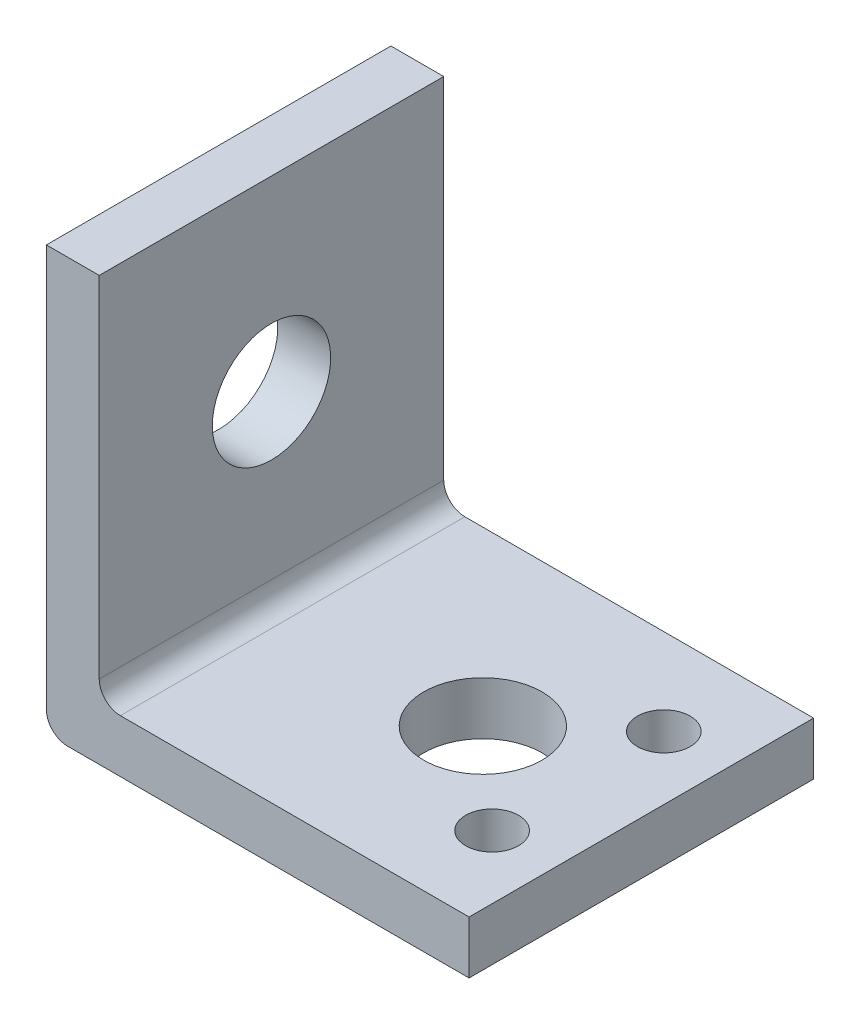
from build123d import *

# Parameters (mm, degrees)
EXTRUDE_1_DEPTH     = 41.402
SKETCH_4_R          = 7.112
CUT_EXTRUDE_1_DEPTH = 83.979969858
SKETCH_3_R          = 7.112
CUT_EXTRUDE_2_DEPTH = 83.979969858
SKETCH1_R           = 3.175
CUT_EXTRUDE1_DEPTH  = 83.979969858


with BuildPart() as part:
    # 草图1 → 凸台-拉伸1 (new body)
    with BuildSketch(Plane.XY):
        with BuildLine():
            Line((2.54, 0), (50.8, 0))
            Line((50.8, 0), (50.8, 6.35))
            Line((50.8, 6.35), (8.89, 6.35))
            ThreePointArc((8.89, 6.35), (7.093948776, 7.093948776), (6.35, 8.89))
            Line((6.35, 8.89), (6.35, 50.900980282))
            Line((6.35, 50.900980282), (0, 50.900980282))
            Line((0, 50.900980282), (0, 2.54))
            ThreePointArc((0, 2.54), (0.743948776, 0.743948776), (2.54, 0))
        make_face()
    extrude(amount=EXTRUDE_1_DEPTH)

    # 草图4 → 切除-拉伸1 (cut, through all)
    with BuildSketch(Plane.ZY):
        with Locations((20.701, 28.448)):
            Circle(SKETCH_4_R)
    extrude(amount=-CUT_EXTRUDE_1_DEPTH, mode=Mode.SUBTRACT)

    # 草图3 → 切除-拉伸2 (cut, through all)
    with BuildSketch(Plane(origin=(0, 0, 0), x_dir=(-1, 0, 0), z_dir=(0, -1, 0))):
        with Locations(Location((-31.75, -20.701, 0), (0, 0, 90))):
            Circle(SKETCH_3_R)
    extrude(amount=-CUT_EXTRUDE_2_DEPTH, mode=Mode.SUBTRACT)

    # Sketch1 → Cut-Extrude1 (cut, through all)
    with BuildSketch(Plane(origin=(0, 0, 0), x_dir=(-1, 0, 0), z_dir=(0, -1, 0))):
        with Locations(Location((-43.18, -10.38225, 0), (0, 0, 90))):
            Circle(SKETCH1_R)
        with Locations(Location((-43.18, -31.01975, 0), (0, 0, 90))):
            Circle(SKETCH1_R)
    extrude(amount=-CUT_EXTRUDE1_DEPTH, mode=Mode.SUBTRACT)


solid = part.part
